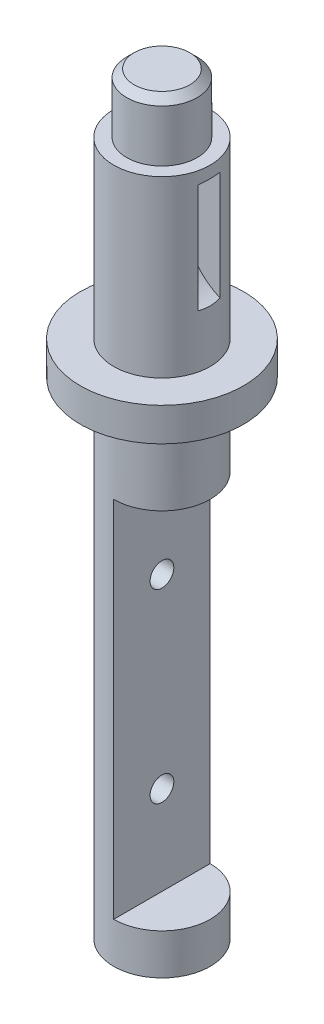
from build123d import *

# Parameters (mm, degrees)
CHAMFER1_SIZE           = 1
CUT_EXTRUDE2_DEPTH      = 103.685198544
CUT_EXTRUDE2_DEPTH_BACK = 103.685198544
SKETCH2_W               = 13.680212399
SKETCH2_H               = 49
SKETCH3_R               = 8
CUT_EXTRUDE3_DEPTH      = 1.5
CUT_EXTRUDE4_DEPTH      = 103.685198544
CUT_EXTRUDE4_DEPTH_BACK = 103.685198544
SKETCH7_R               = 1.6


with BuildPart() as part:
    # Sketch1 → Revolve1 (revolve)
    with BuildSketch(Plane.XY, mode=Mode.PRIVATE) as revolve1_sk:
        Polygon((0, 0), (6.5, 0), (6.5, 65.5), (11, 65.5), (11, 70), (6.5, 70), (6.5, 93.5), (4.75, 93.5), (4.75, 101.5), (0, 101.5), align=None)
    revolve(revolve1_sk.sketch.rotate(Axis((0, 101.5, 0), (0, -1, 0)), 180), axis=Axis((0, 101.5, 0), (0, -1, 0)))

    # Chamfer1
    chamfer1_edges = [part.edges().sort_by_distance(p)[0] for p in [
        (4.75, 101.5, 0),
    ]]
    chamfer(chamfer1_edges, length=CHAMFER1_SIZE)

    # Sketch2 → Cut-Extrude2 (cut, two sides: drawn at the far end of the back side and taken through both)
    with BuildSketch(Plane.XY.offset(-CUT_EXTRUDE2_DEPTH_BACK)):
        with Locations((6.8401062, 30)):
            Rectangle(SKETCH2_W, SKETCH2_H)
    extrude(amount=CUT_EXTRUDE2_DEPTH + CUT_EXTRUDE2_DEPTH_BACK, mode=Mode.SUBTRACT)

    # Sketch3 → Cut-Extrude3 (cut, symmetric)
    with BuildSketch(Plane.XY):
        with Locations((9.5, 84.5)):
            Circle(SKETCH3_R)
    extrude(amount=CUT_EXTRUDE3_DEPTH, both=True, mode=Mode.SUBTRACT)

    # Sketch7 → Cut-Extrude4 (cut, two sides: drawn at the far end of the back side and taken through both)
    with BuildSketch(Plane(origin=(0, 0, 0), x_dir=(0, 0, -1), z_dir=(1, 0, 0)).offset(-CUT_EXTRUDE4_DEPTH_BACK)):
        with Locations(Location((0, 42.5, 0), (0, 0, 270))):
            Circle(SKETCH7_R)
        with Locations(Location((0, 17.5, 0), (0, 0, 270))):
            Circle(SKETCH7_R)
    extrude(amount=CUT_EXTRUDE4_DEPTH + CUT_EXTRUDE4_DEPTH_BACK, mode=Mode.SUBTRACT)


solid = part.part
